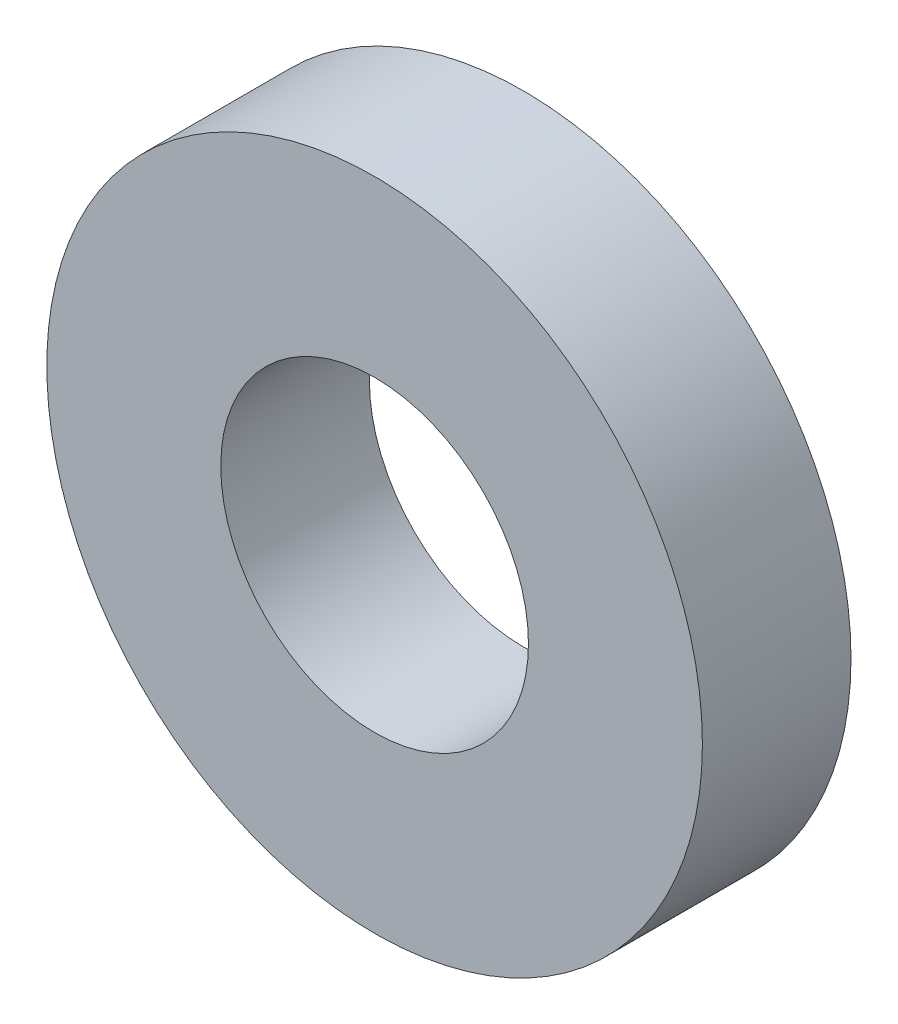
from build123d import *

# Parameters (mm, degrees)
SKETCH1_R           = 37.5
SKETCH1_R_2         = 17.6
BOSS_EXTRUDE1_DEPTH = 8.5


with BuildPart() as part:
    # Sketch1 → Boss-Extrude1 (new, symmetric)
    with BuildSketch(Plane.XY):
        Circle(SKETCH1_R)
        Circle(SKETCH1_R_2, mode=Mode.SUBTRACT)
    extrude(amount=BOSS_EXTRUDE1_DEPTH, both=True)


solid = part.part
